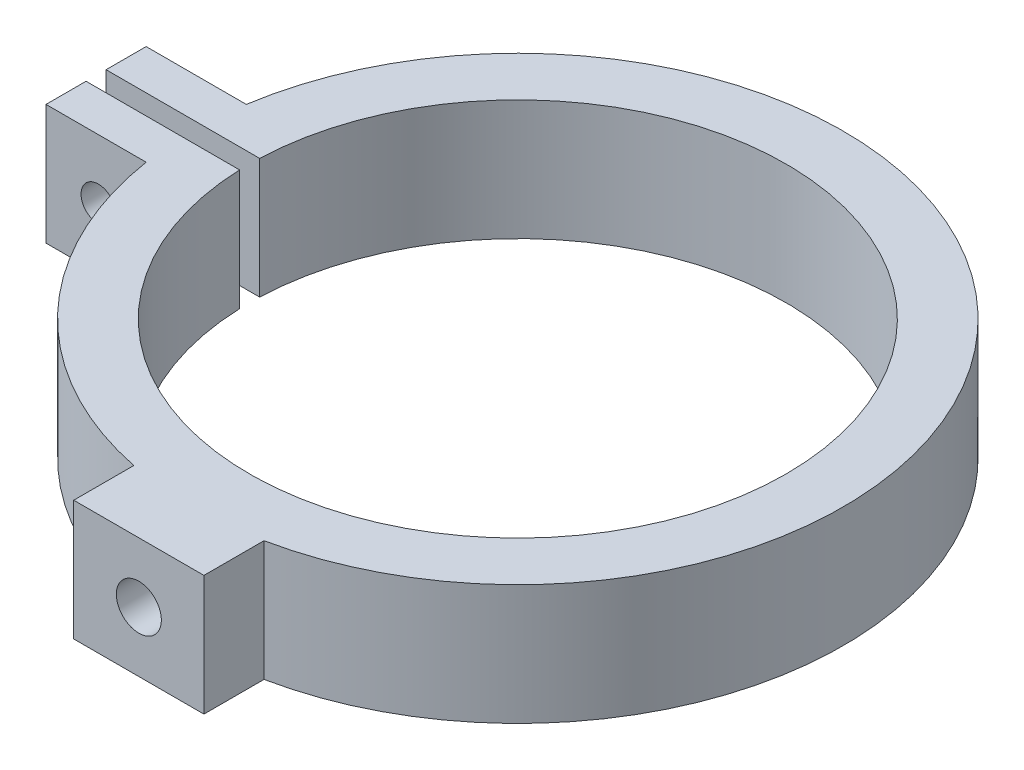
from build123d import *

# Parameters (mm, degrees)
SKETCH1_R                                      = 26.8
BOSS_EXTRUDE1_DEPTH                            = 6
CBORE_FOR_8_SOCKET_HEAD_CAP_SCREW1_D           = 4.4958
CBORE_FOR_8_SOCKET_HEAD_CAP_SCREW1_DEPTH       = 11.043366656
CBORE_FOR_8_SOCKET_HEAD_CAP_SCREW1_CBORE_D     = 7.9375
CBORE_FOR_8_SOCKET_HEAD_CAP_SCREW1_CBORE_DEPTH = 4.1656
SKETCH3_W                                      = 37.2978219
SKETCH3_H                                      = 2
CUT_EXTRUDE1_DEPTH                             = 12
BOSS_EXTRUDE2_DEPTH                            = 12
F_8_32_TAPPED_HOLE1_D                          = 3.4544
F_8_CLEARANCE_HOLE1_D                          = 4.9149
F_8_CLEARANCE_HOLE1_DEPTH                      = 4
F_8_CLEARANCE_HOLE1_TIP                        = 1.476584928


with BuildPart() as part:
    # Sketch1 → Boss-Extrude1 (new, symmetric)
    with BuildSketch(Plane(origin=(0, 0, 0), x_dir=(1, 0, 0), z_dir=(0, 1, 0))):
        with BuildLine():
            Line((6.5, -31.843366656), (6.5, -37.843366656))
            Line((6.5, -37.843366656), (-6.5, -37.843366656))
            Line((-6.5, -37.843366656), (-6.5, -31.843366656))
            ThreePointArc((-6.5, -31.843366656), (0, 32.5), (6.5, -31.843366656))
        make_face()
        with Locations(Location((0, 0, 0), (0, 0, 270))):
            Circle(SKETCH1_R, mode=Mode.SUBTRACT)
    extrude(amount=BOSS_EXTRUDE1_DEPTH, both=True)

    # CBORE for #8 Socket Head Cap Screw1
    with Locations(Plane(origin=(0, 0, 26.8), x_dir=(-1, 0, 0), z_dir=(0, 0, -1))):
        with Locations((0, 0)):
            CounterBoreHole(CBORE_FOR_8_SOCKET_HEAD_CAP_SCREW1_D / 2, CBORE_FOR_8_SOCKET_HEAD_CAP_SCREW1_CBORE_D / 2, CBORE_FOR_8_SOCKET_HEAD_CAP_SCREW1_CBORE_DEPTH, depth=CBORE_FOR_8_SOCKET_HEAD_CAP_SCREW1_DEPTH)

    # Sketch3 → Cut-Extrude1 (cut)
    with BuildSketch(Plane(origin=(0, 6, 0), x_dir=(1, 0, 0), z_dir=(0, 1, 0))):
        with Locations((-18.64891095, 0)):
            Rectangle(SKETCH3_W, SKETCH3_H)
    extrude(amount=-CUT_EXTRUDE1_DEPTH, mode=Mode.SUBTRACT)

    # Sketch4 → Boss-Extrude2 (add)
    with BuildSketch(Plane(origin=(0, 6, 0), x_dir=(1, 0, 0), z_dir=(0, 1, 0))):
        with BuildLine():
            Line((-32.484611742, -1), (-42.113081447, -1))
            Line((-42.113081447, -1), (-42.113081447, -5))
            Line((-42.113081447, -5), (-32.113081447, -5))
            ThreePointArc((-32.113081447, -5), (-32.360709067, -3.005745946), (-32.484611742, -1))
        make_face()
        with BuildLine():
            Line((-32.484611742, 1), (-42.113081447, 1))
            Line((-42.113081447, 1), (-42.113081447, 5))
            Line((-42.113081447, 5), (-32.113081447, 5))
            ThreePointArc((-32.113081447, 5), (-32.360709067, 3.005745946), (-32.484611742, 1))
        make_face()
    extrude(amount=-BOSS_EXTRUDE2_DEPTH)

    # #8-32 Tapped Hole1 (through all)
    with Locations(Plane(origin=(0, 0, -5), x_dir=(-1, 0, 0), z_dir=(0, 0, -1))):
        with Locations((36.885640573, 0)):
            Hole(F_8_32_TAPPED_HOLE1_D / 2)

    # #8 Clearance Hole1
    with Locations(Plane(origin=(0, 0, -5), x_dir=(-1, 0, 0), z_dir=(0, 0, -1))):
        with Locations((36.885640573, 0)):
            Hole(F_8_CLEARANCE_HOLE1_D / 2, depth=F_8_CLEARANCE_HOLE1_DEPTH)
            with Locations((0, 0, -(F_8_CLEARANCE_HOLE1_DEPTH + F_8_CLEARANCE_HOLE1_TIP / 2))):  # 118° drill point
                Cone(0, F_8_CLEARANCE_HOLE1_D / 2, F_8_CLEARANCE_HOLE1_TIP, mode=Mode.SUBTRACT)


solid = part.part
